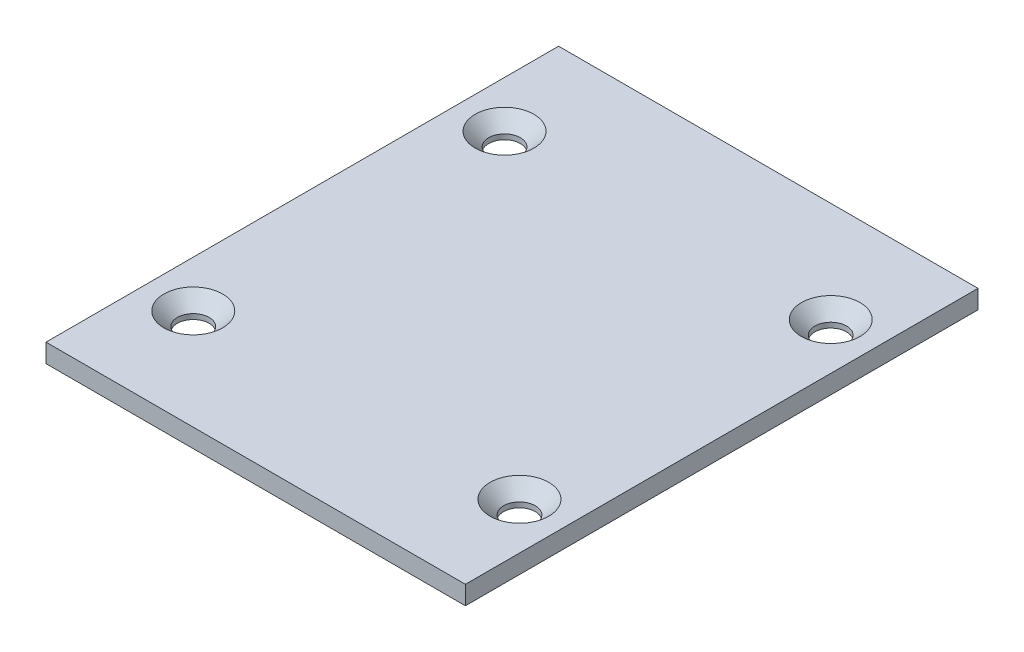
from build123d import *

# Parameters (mm, degrees)
SKETCH1_W                                      = 45
SKETCH1_H                                      = 55
SKETCH1_W_2                                    = 5
SKETCH1_H_2                                    = 2
BOSS_EXTRUDE1_DEPTH                            = 2
CSK_FOR_M3_FLAT_HEAD_MACHINE_SCREW1_AT_2_COUNT = 2
CSK_FOR_M3_FLAT_HEAD_MACHINE_SCREW1_AT_2_PITCH = 35
CSK_FOR_M3_FLAT_HEAD_MACHINE_SCREW1_AT_3_COUNT = 2
CSK_FOR_M3_FLAT_HEAD_MACHINE_SCREW1_AT_3_PITCH = 48.379334431
CSK_FOR_M3_FLAT_HEAD_MACHINE_SCREW1_AT_4_COUNT = 2
CSK_FOR_M3_FLAT_HEAD_MACHINE_SCREW1_AT_4_PITCH = 33.4


with BuildPart() as part:
    # Sketch1 → Boss-Extrude1 (new body)
    # profile 1 of 3: a face of its own
    with BuildSketch(Plane(origin=(0, 0, 0), x_dir=(1, 0, 0), z_dir=(0, 1, 0))):
        Rectangle(SKETCH1_W, SKETCH1_H)
        with Locations((0, 26.25)):
            Rectangle(SKETCH1_W_2, SKETCH1_H_2, mode=Mode.SUBTRACT)
        with Locations((0, -26.25)):
            Rectangle(SKETCH1_W_2, SKETCH1_H_2, mode=Mode.SUBTRACT)
    # profile 2 of 3: a face of its own
    with BuildSketch(Plane(origin=(0, 0, 0), x_dir=(1, 0, 0), z_dir=(0, 1, 0))):
        with Locations((0, 26.25)):
            Rectangle(SKETCH1_W_2, SKETCH1_H_2)
    # profile 3 of 3: a face of its own
    with BuildSketch(Plane(origin=(0, 0, 0), x_dir=(1, 0, 0), z_dir=(0, 1, 0))):
        with Locations((0, -26.25)):
            Rectangle(SKETCH1_W_2, SKETCH1_H_2)
    extrude(amount=BOSS_EXTRUDE1_DEPTH)

    # Sketch5 → CSK for M3 Flat Head Machine Screw1 (revolve, cut)
    with BuildSketch(Plane(origin=(-17.5, 2, -16.7), x_dir=(0, 0, 1), z_dir=(1, 0, 0))):
        Polygon((0, 0), (0, 2), (1.7, 2), (1.7, 1.45), (3.15, 0), align=None)
    csk_for_m3_flat_head_machine_screw1 = revolve(axis=Axis((-17.5, 8.35, -16.7), (0, -1, 0)), mode=Mode.SUBTRACT)

    # CSK for M3 Flat Head Machine Screw1 at 2: CSK for M3 Flat Head Machine Screw1 ×2
    with Locations(*[(i * CSK_FOR_M3_FLAT_HEAD_MACHINE_SCREW1_AT_2_PITCH, 0, 0) for i in range(1, CSK_FOR_M3_FLAT_HEAD_MACHINE_SCREW1_AT_2_COUNT)]):
        add(csk_for_m3_flat_head_machine_screw1, mode=Mode.SUBTRACT)

    # CSK for M3 Flat Head Machine Screw1 at 3: CSK for M3 Flat Head Machine Screw1 ×2
    with Locations(*[Vector(0.7234493903552432, 0, 0.6903774182247178) * (i * CSK_FOR_M3_FLAT_HEAD_MACHINE_SCREW1_AT_3_PITCH) for i in range(1, CSK_FOR_M3_FLAT_HEAD_MACHINE_SCREW1_AT_3_COUNT)]):
        add(csk_for_m3_flat_head_machine_screw1, mode=Mode.SUBTRACT)

    # CSK for M3 Flat Head Machine Screw1 at 4: CSK for M3 Flat Head Machine Screw1 ×2
    with Locations(*[(0, 0, i * CSK_FOR_M3_FLAT_HEAD_MACHINE_SCREW1_AT_4_PITCH) for i in range(1, CSK_FOR_M3_FLAT_HEAD_MACHINE_SCREW1_AT_4_COUNT)]):
        add(csk_for_m3_flat_head_machine_screw1, mode=Mode.SUBTRACT)


solid = part.part
